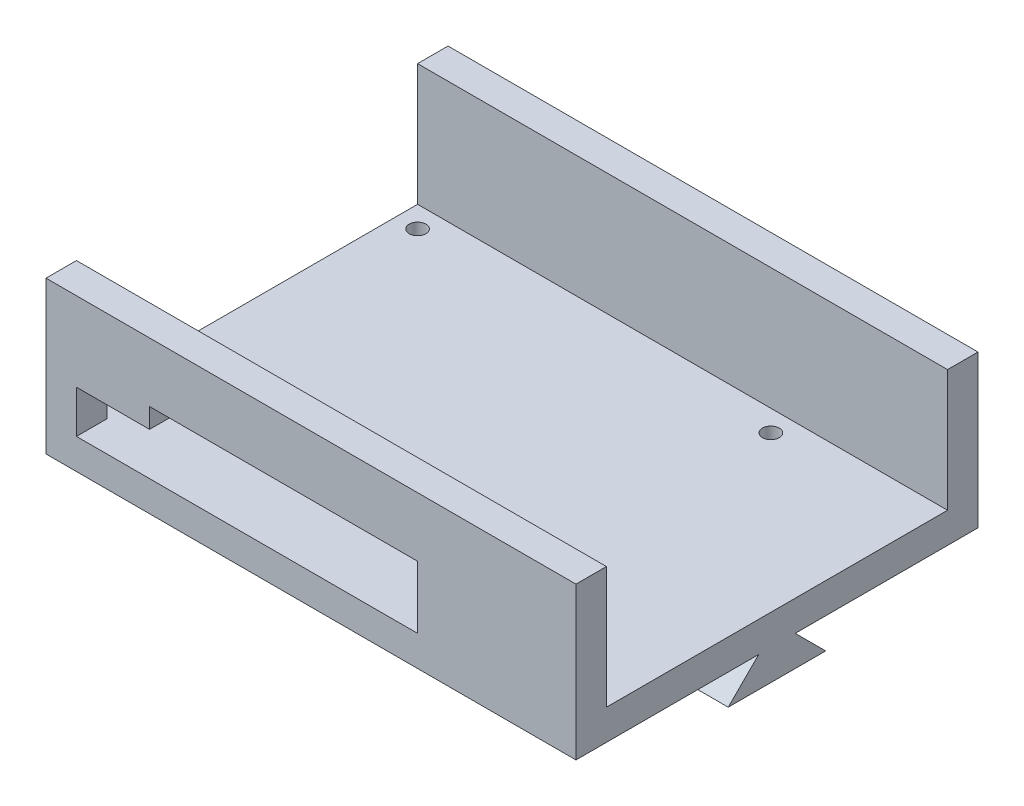
from build123d import *

# Parameters (mm, degrees)
SKETCH1_W                = 87
SKETCH1_H                = 66
SKETCH1_R                = 1.375
BOSS_EXTRUDE1_DEPTH      = 10
CUT_EXTRUDE1_DEPTH       = 56.509008278
CUT_EXTRUDE1_DEPTH_BACK  = 56.509008278
BOSS_EXTRUDE2_DEPTH      = 43.5
BOSS_EXTRUDE2_DEPTH_BACK = 43.5
SKETCH3_W                = 5
SKETCH3_H                = 20
CUT_EXTRUDE2_DEPTH       = 10


with BuildPart() as part:
    # Sketch1 → Boss-Extrude1 (new body)
    with BuildSketch(Plane(origin=(0, 0, 0), x_dir=(1, 0, 0), z_dir=(0, 1, 0))):
        Rectangle(SKETCH1_W, SKETCH1_H)
        with Locations(Location((-40, 24.5, 0), (0, 0, 270))):
            Circle(SKETCH1_R, mode=Mode.SUBTRACT)
        with Locations(Location((-40, -24.5, 0), (0, 0, 270))):
            Circle(SKETCH1_R, mode=Mode.SUBTRACT)
        with Locations(Location((18, 24.5, 0), (0, 0, 270))):
            Circle(SKETCH1_R, mode=Mode.SUBTRACT)
        with Locations(Location((18, -24.5, 0), (0, 0, 270))):
            Circle(SKETCH1_R, mode=Mode.SUBTRACT)
    extrude(amount=BOSS_EXTRUDE1_DEPTH)

    # Sketch2 → Cut-Extrude1 (cut, two sides: drawn at the far end of the back side and taken through both)
    with BuildSketch(Plane(origin=(0, 0, 0), x_dir=(0, 0, -1), z_dir=(1, 0, 0)).offset(-CUT_EXTRUDE1_DEPTH_BACK)):
        Polygon((33, 5), (3, 5), (8, 0), (33, 0), align=None)
        Polygon((-33, 5), (-3, 5), (-8, 0), (-33, 0), align=None)
    extrude(amount=CUT_EXTRUDE1_DEPTH + CUT_EXTRUDE1_DEPTH_BACK, mode=Mode.SUBTRACT)

    # Sketch3 → Boss-Extrude2 (add, two sides: drawn at the far end of the back side and taken through both)
    with BuildSketch(Plane(origin=(0, 0, 0), x_dir=(0, 0, -1), z_dir=(1, 0, 0)).offset(-BOSS_EXTRUDE2_DEPTH_BACK)):
        with Locations((30.5, 20)):
            Rectangle(SKETCH3_W, SKETCH3_H)
        with Locations((-30.5, 20)):
            Rectangle(SKETCH3_W, SKETCH3_H)
    extrude(amount=BOSS_EXTRUDE2_DEPTH + BOSS_EXTRUDE2_DEPTH_BACK)

    # Sketch4 → Cut-Extrude2 (cut)
    with BuildSketch(Plane.XY.offset(33)):
        Polygon((-26.5, 17), (-26.5, 20.250689265), (17.5, 20.250689265), (17.5, 10), (-26.5, 10), (-38.5, 10), (-38.5, 17), align=None)
    extrude(amount=-CUT_EXTRUDE2_DEPTH, mode=Mode.SUBTRACT)


solid = part.part
